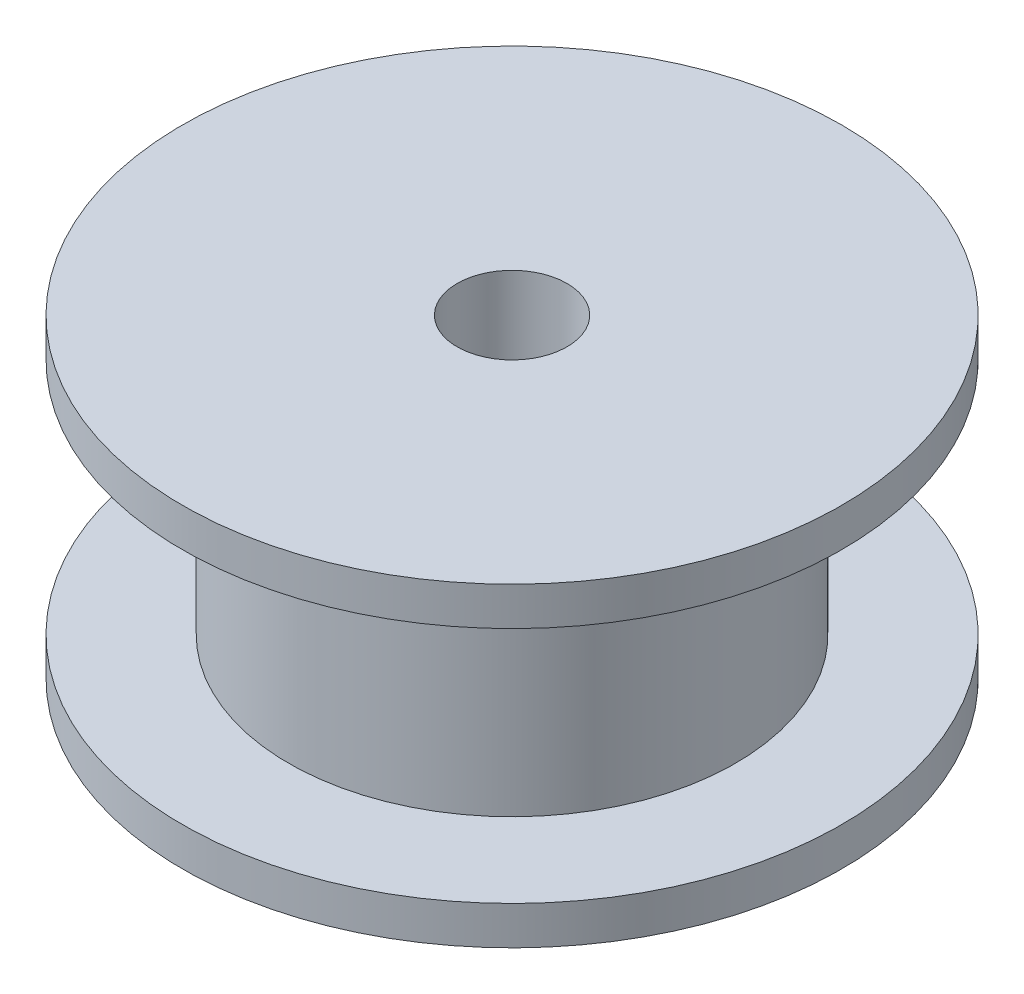
from build123d import *


with BuildPart() as part:
    # Esboço1 → Revolução1 (revolve)
    with BuildSketch(Plane.XY, mode=Mode.PRIVATE) as revolu_o1_sk:
        Polygon((1.5, 8.6), (9, 8.6), (9, 7.55), (6.1, 7.55), (6.1, 1.05), (9, 1.05), (9, 0), (1.5, 0), align=None)
    revolve(revolu_o1_sk.sketch.rotate(Axis((0, 0, 0), (0, 1, 0)), 90), axis=Axis((0, 0, 0), (0, 1, 0)))


solid = part.part
